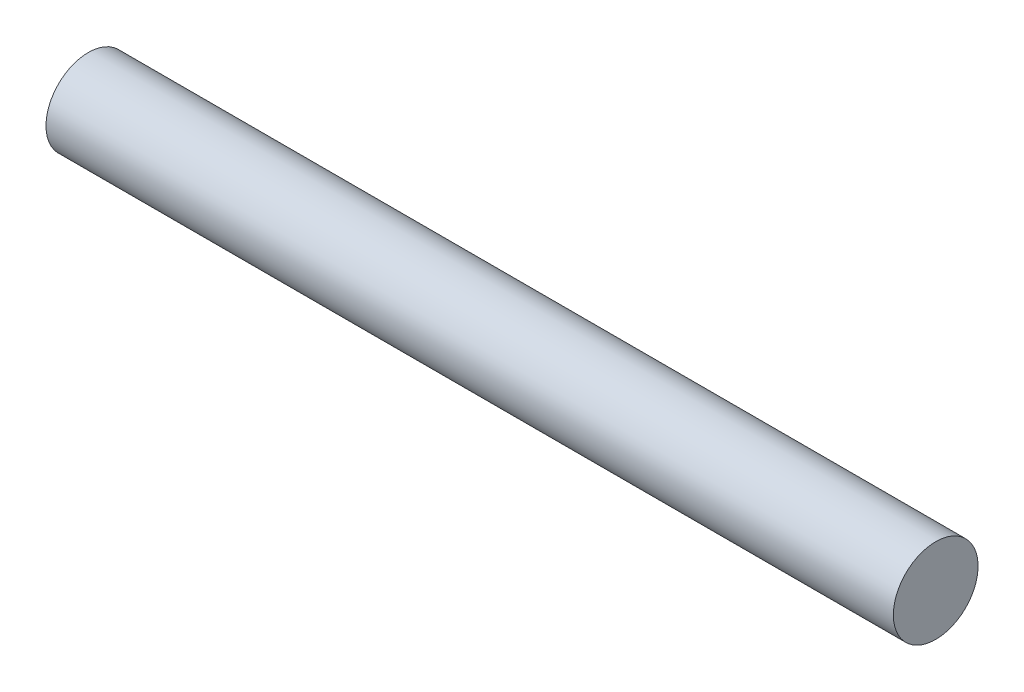
from build123d import *

# Parameters (mm, degrees)
SKETCH1_W = 100
SKETCH1_H = 5


with BuildPart() as part:
    # Sketch1 → Revolve1 (revolve)
    with BuildSketch(Plane.XY, mode=Mode.PRIVATE) as revolve1_sk:
        Rectangle(SKETCH1_W, SKETCH1_H)
    revolve(revolve1_sk.sketch.rotate(Axis((-50, -2.5, 0), (1, 0, 0)), 90), axis=Axis((-50, -2.5, 0), (1, 0, 0)))


solid = part.part
